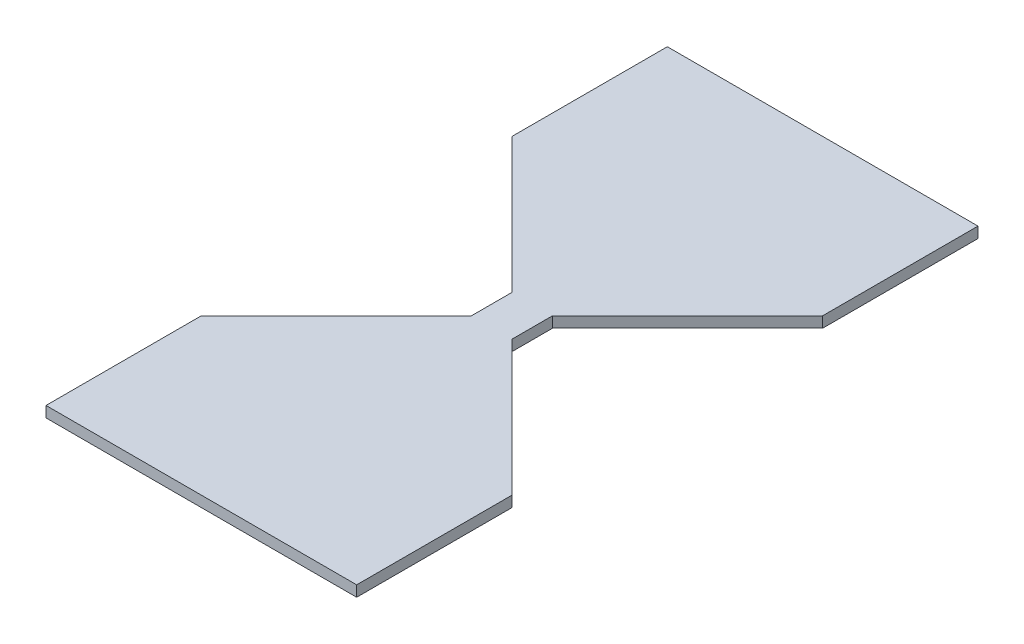
from build123d import *

# Parameters (mm, degrees)
EXTRUDE_1_DEPTH = 1.6


with BuildPart() as part:
    # 草图1 → 凸台-拉伸1 (new body)
    with BuildSketch(Plane(origin=(0, 0, 0), x_dir=(1, 0, 0), z_dir=(0, 1, 0))):
        Polygon((0, 0), (46, 0), (46, 23), (26.000191801, 42.999808199), (26.000191801, 48.999808199), (46, 68.999616398), (46, 91.999616398), (0, 91.999616398), (0, 68.999616398), (19.999808199, 48.999808199), (19.999808199, 42.999808199), (0, 23), align=None)
    extrude(amount=EXTRUDE_1_DEPTH)


solid = part.part
